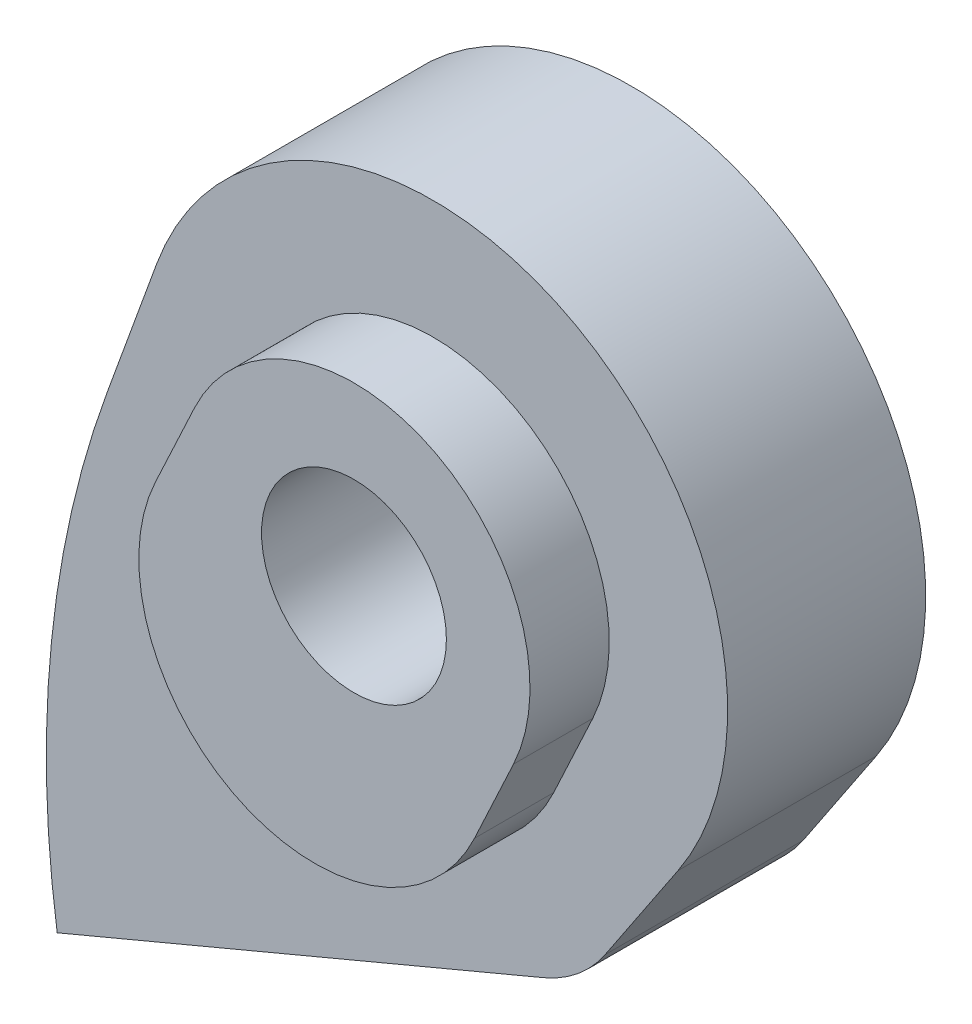
from build123d import *
from build123d.topology import SkipClean

# Parameters (mm, degrees)
SKETCH3_R           = 2.75
SKETCH3_R_2         = 2.1
BOSS_EXTRUDE2_DEPTH = 11
BOSS_EXTRUDE4_START = 4.5
BOSS_EXTRUDE4_DEPTH = 4.5
BOSS_EXTRUDE3_START = 3
BOSS_EXTRUDE3_DEPTH = 3
SKETCH14_W          = 47.285712055
SKETCH14_H          = 12.595473758
CUT_EXTRUDE1_DEPTH  = 92.326119258
BOSS_EXTRUDE5_DEPTH = 1.8
SKETCH15_R          = 2.1
CUT_EXTRUDE2_DEPTH  = 88.749019959


with BuildPart() as part:
    # Sketch3 → Boss-Extrude2 (new body)
    with BuildSketch(Plane.XY):
        with BuildLine():
            Line((11.81639044, 60.252883085), (11.728372068, 60.311638564))
            ThreePointArc((11.728372068, 60.311638564), (8.917204522, 62.7925154), (6.866230988, 65.931132995))
            ThreePointArc((6.866230988, 65.931132995), (6.025591445, 67.274340702), (4.901176311, 68.390840765))
            ThreePointArc((4.901176311, 68.390840765), (3.375934297, 70.989881123), (4.020351516, 73.93370524))
            Line((4.020351516, 73.93370524), (5.678869184, 76.41823992))
            ThreePointArc((5.678869184, 76.41823992), (3.137547336, 86.100651278), (-6.171856019, 82.420649156))
            Line((-6.171856019, 82.420649156), (-7.290261888, 79.347854286))
            ThreePointArc((-7.290261888, 79.347854286), (-8.557893098, 69.185727028), (-5.279809822, 59.483671095))
            ThreePointArc((-5.279809822, 59.483671095), (-2.848156457, 57.139360441), (0.414833066, 56.266646336))
            ThreePointArc((0.414833066, 56.266646336), (3.287818882, 55.822166382), (5.91364728, 54.574514525))
            Line((5.91364728, 54.574514525), (7.374782695, 53.599153256))
            ThreePointArc((7.374782695, 53.599153256), (10.815902262, 50.678650143), (13.499590609, 47.049812979))
            ThreePointArc((13.499590609, 47.049812979), (24.965953819, 46.665736496), (20.21385057, 57.108078892))
            ThreePointArc((20.21385057, 57.108078892), (15.833272198, 58.194897845), (11.81639044, 60.252883085))
        make_face()
        with Locations((19.351869275, 50.413343031)):
            Circle(SKETCH3_R, mode=Mode.SUBTRACT)
        with Locations((0.471910886, 63.016405008)):
            Circle(SKETCH3_R, mode=Mode.SUBTRACT)
        with Locations((0.114687614, 80.132534397)):
            Circle(SKETCH3_R_2, mode=Mode.SUBTRACT)
    extrude(amount=BOSS_EXTRUDE2_DEPTH)

    # Sketch13 → Boss-Extrude4 (add)
    with SkipClean():  # the faces are left unmerged after this step: merging them gives an invalid solid
        with BuildSketch(Plane(origin=(0, 0, 0), x_dir=(-1, 0, 0), z_dir=(0, 0, -1)).offset(BOSS_EXTRUDE4_START)):
            with BuildLine():
                Line((-5.678869184, 76.41823992), (-4.020351516, 73.93370524))
                ThreePointArc((-4.020351516, 73.93370524), (-3.407782277, 73.255690271), (-2.625844204, 72.782913134))
                Line((-2.625844204, 72.782913134), (8.427696777, 68.139691908))
                ThreePointArc((8.427696777, 68.139691908), (8.557268078, 73.814637343), (7.290261888, 79.347854286))
                Line((7.290261888, 79.347854286), (6.171856019, 82.420649156))
                ThreePointArc((6.171856019, 82.420649156), (-3.137547336, 86.100651278), (-5.678869184, 76.41823992))
            make_face()
        extrude(amount=-BOSS_EXTRUDE4_DEPTH)

    # Sketch12 → Boss-Extrude3 (add)
    with SkipClean():  # the faces are left unmerged after this step: merging them gives an invalid solid
        with BuildSketch(Plane(origin=(0, 0, -4.5), x_dir=(-1, 0, 0), z_dir=(0, 0, -1)).offset(BOSS_EXTRUDE3_START)):
            with BuildLine():
                Line((8.013597957, 76.965805827), (4.924247842, 69.611373108))
                Line((4.924247842, 69.611373108), (8.427696777, 68.139691908))
                ThreePointArc((8.427696777, 68.139691908), (8.649339764, 72.572862025), (8.013597957, 76.965805827))
            make_face()
        extrude(amount=-BOSS_EXTRUDE3_DEPTH)

    # Sketch14 → Cut-Extrude1 (cut, through all)
    with BuildSketch(Plane(origin=(0, 0, 0), x_dir=(1, 0, 0), z_dir=(0, 1, 0))):
        with Locations((8.412006537, -6.297736879)):
            Rectangle(SKETCH14_W, SKETCH14_H)
    extrude(amount=CUT_EXTRUDE1_DEPTH, mode=Mode.SUBTRACT)

    # Sketch16 → Boss-Extrude5 (add)
    with BuildSketch(Plane.XY):
        with BuildLine():
            Line((3.739918762, 78.44206135), (2.852420412, 76.538814997))
            ThreePointArc((2.852420412, 76.538814997), (-2.463283783, 74.604056896), (-4.398041884, 79.919761091))
            Line((-4.398041884, 79.919761091), (-3.510543534, 81.823007444))
            ThreePointArc((-3.510543534, 81.823007444), (1.805160661, 83.757765545), (3.739918762, 78.44206135))
        make_face()
    extrude(amount=BOSS_EXTRUDE5_DEPTH)

    # Sketch15 → Cut-Extrude2 (cut, through all)
    with BuildSketch(Plane.XY.offset(1.8)):
        with Locations((0.114687614, 80.132534397)):
            Circle(SKETCH15_R)
    extrude(amount=-CUT_EXTRUDE2_DEPTH, mode=Mode.SUBTRACT)


solid = part.part
